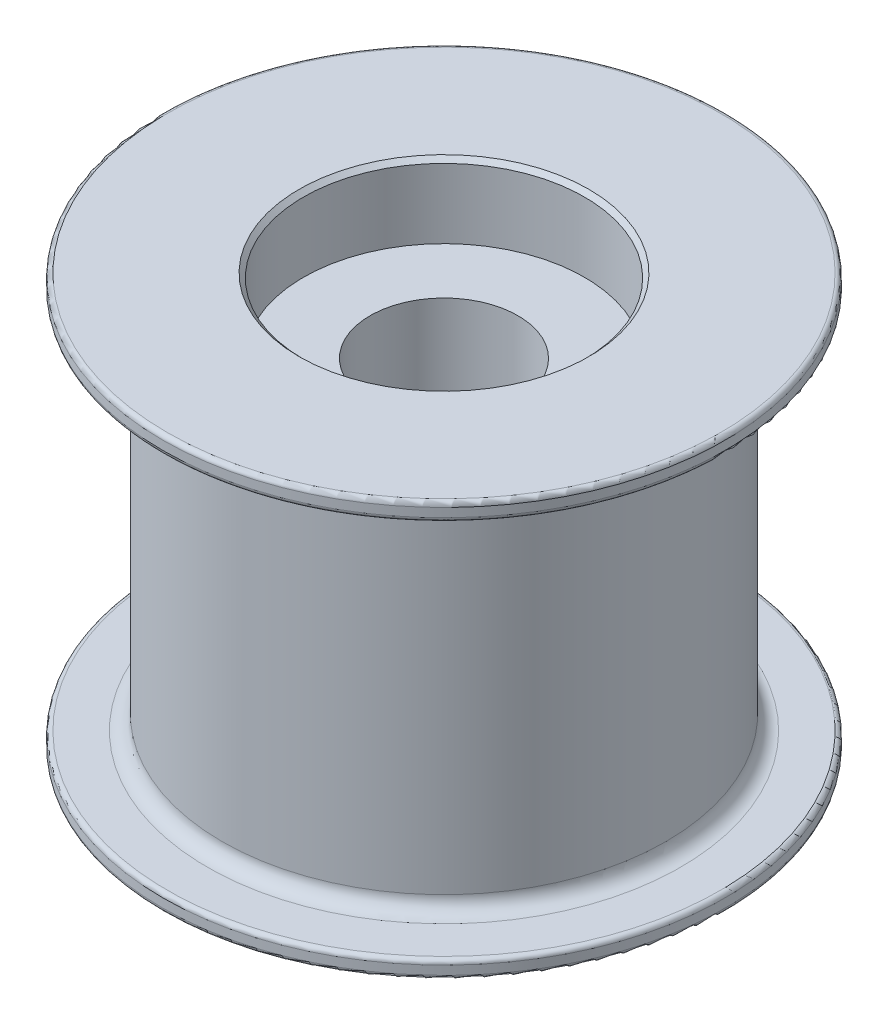
from build123d import *

# Parameters (mm, degrees)
FILLET1_R     = 1
CHAMFER1_SIZE = 0.3
FILLET2_R     = 0.3


with BuildPart() as part:
    # Sketch1 → Revolve1 (revolve)
    with BuildSketch(Plane.XY):
        Polygon((-9.5, 14), (-19, 14), (-19, 12.8), (-15, 12.8), (-15, 0), (-5, 0), (-5, 9), (-9.5, 9), align=None)
    revolve(axis=Axis((0, 11.942857143, 0), (0, -1, 0)))

    # Fillet1
    fillet1_edges = [part.edges().sort_by_distance(p)[0] for p in [
        (15, 12.8, 0),
    ]]
    fillet(fillet1_edges, radius=FILLET1_R)

    # Chamfer1
    chamfer1_edges = [part.edges().sort_by_distance(p)[0] for p in [
        (9.5, 14, 0),
    ]]
    chamfer(chamfer1_edges, length=CHAMFER1_SIZE)

    # Fillet2
    fillet2_edges = [part.edges().sort_by_distance(p)[0] for p in [
        (19, 14, 0),
        (19, 12.8, 0),
    ]]
    fillet(fillet2_edges, radius=FILLET2_R)

    # Mirror1: part across plane


with BuildPart() as part_1:
    add(part.part)
    add(part.part.mirror(Plane(origin=(-15, 0, 0), x_dir=(0, 0, 1), z_dir=(0, -1, 0))))


solid = part_1.part
